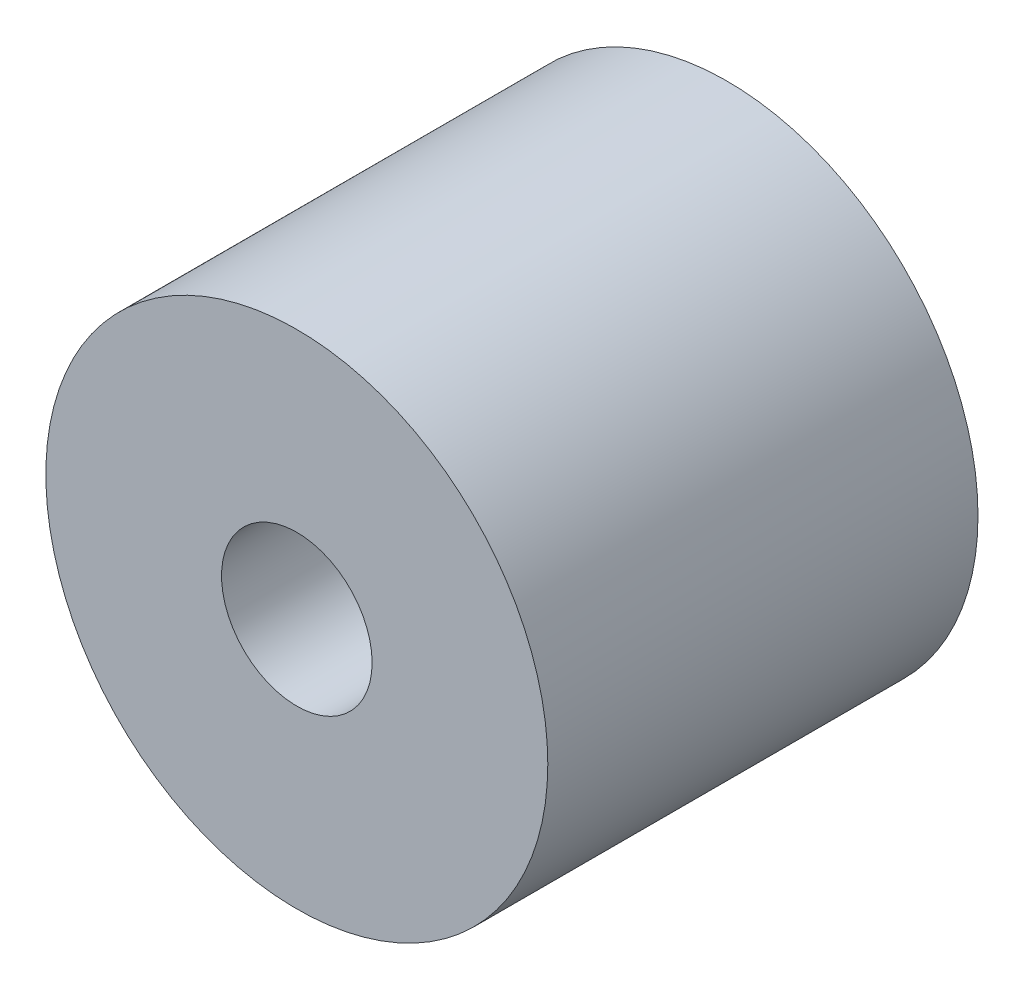
from build123d import *

# Parameters (mm, degrees)
SKETCH1_R           = 7.5
SKETCH1_R_2         = 2.25
BOSS_EXTRUDE1_DEPTH = 12.855


with BuildPart() as part:
    # Sketch1 → Boss-Extrude1 (new body)
    with BuildSketch(Plane.XY):
        Circle(SKETCH1_R)
        Circle(SKETCH1_R_2, mode=Mode.SUBTRACT)
    extrude(amount=BOSS_EXTRUDE1_DEPTH)


solid = part.part
